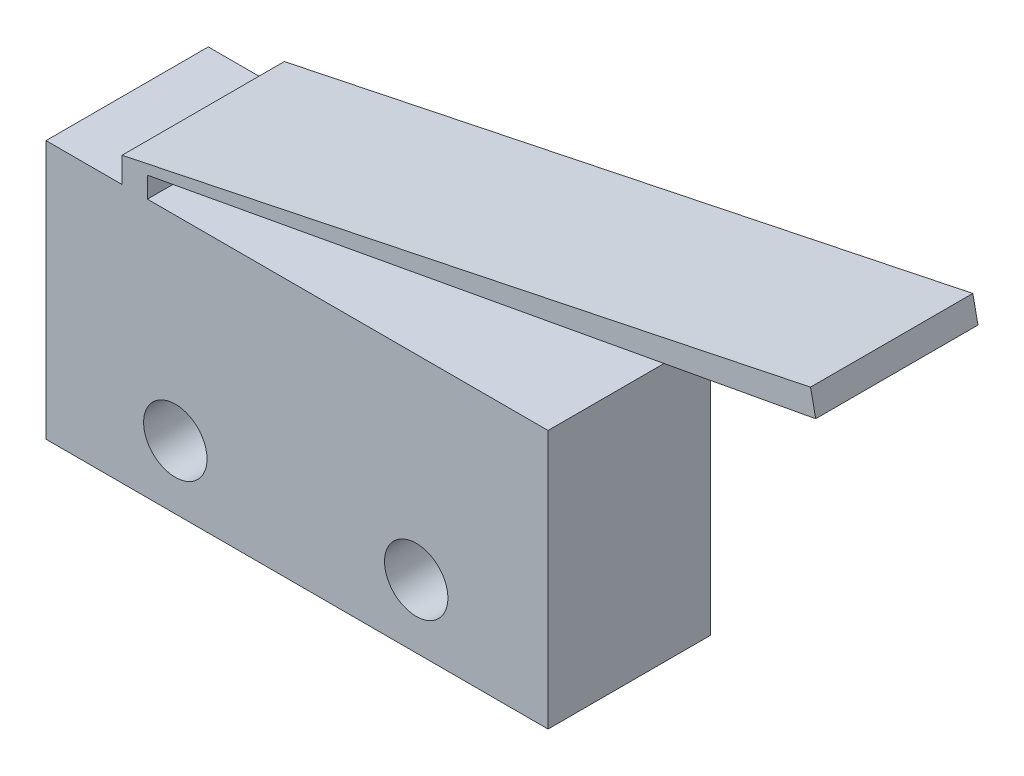
from build123d import *

# Parameters (mm, degrees)
SKETCH_1_W      = 19.8
SKETCH_1_H      = 10.2
SKETCH_1_R      = 1.25
EXTRUDE_1_DEPTH = 6.4


with BuildPart() as part:
    # 草图1 → 凸台-拉伸1 (new body)
    # profile 1 of 3: a face of its own
    with BuildSketch(Plane.XY):
        with Locations((4.8, 2.6)):
            Rectangle(SKETCH_1_W, SKETCH_1_H)
        with Locations((9.5, 0)):
            Circle(SKETCH_1_R, mode=Mode.SUBTRACT)
        Circle(SKETCH_1_R, mode=Mode.SUBTRACT)
    # profile 2 of 3: a face of its own
    with BuildSketch(Plane.XY):
        Polygon((-2.1, 8.7), (-2.1, 7.7), (-1.1, 7.7), (-1.1, 8.520009061), align=None)
    # profile 3 of 3: a face of its own
    with BuildSketch(Plane.XY):
        Polygon((-2.1, 8.7), (25.05212145, 14.356691969), (25.256075705, 13.377711549), (-1.1, 8.520009061), align=None)
    extrude(amount=EXTRUDE_1_DEPTH)


solid = part.part
